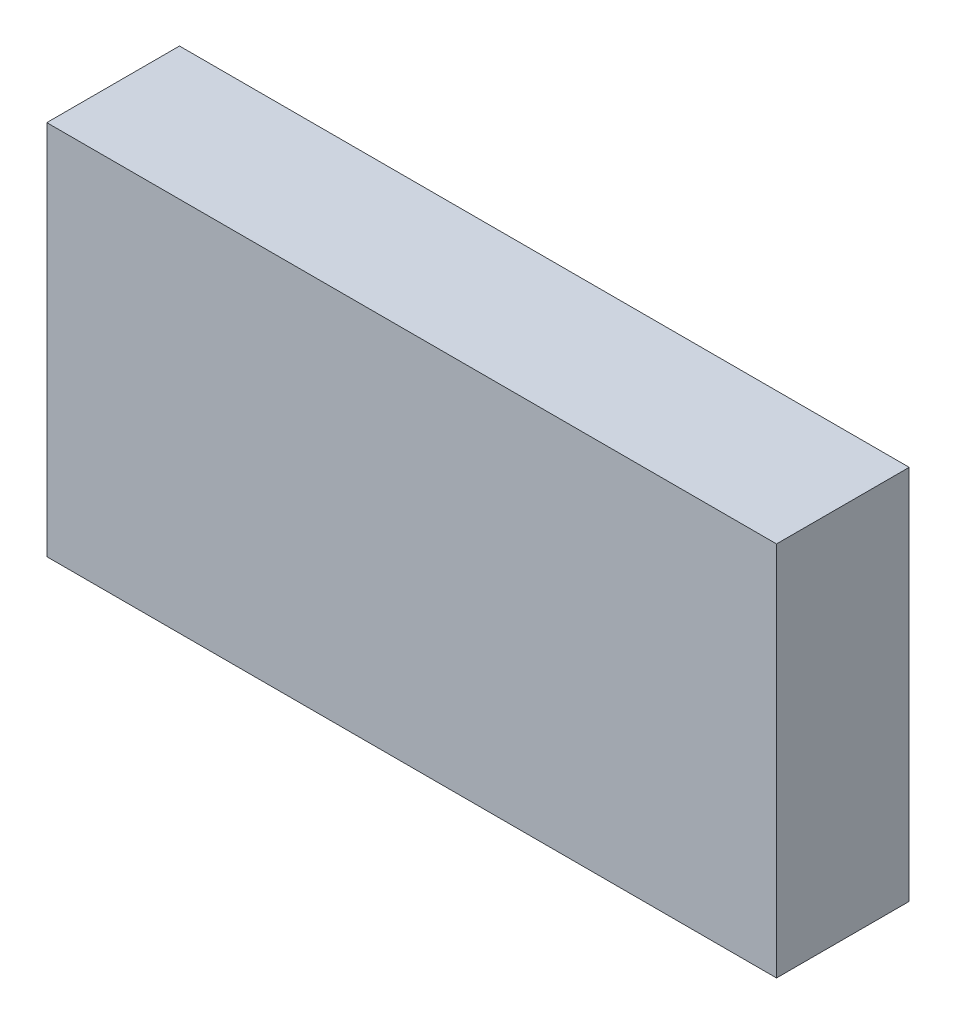
from build123d import *

# Parameters (mm, degrees)
SKETCH_2_W      = 3.3
SKETCH_2_H      = 1.7
EXTRUDE_1_DEPTH = 0.6


with BuildPart() as part:
    # Эскиз2 → Вытянуть1 (new body)
    with BuildSketch(Plane.XY.offset(0.025)):
        with Locations((1.375, 0)):
            Rectangle(SKETCH_2_W, SKETCH_2_H)
    extrude(amount=EXTRUDE_1_DEPTH)


solid = part.part
